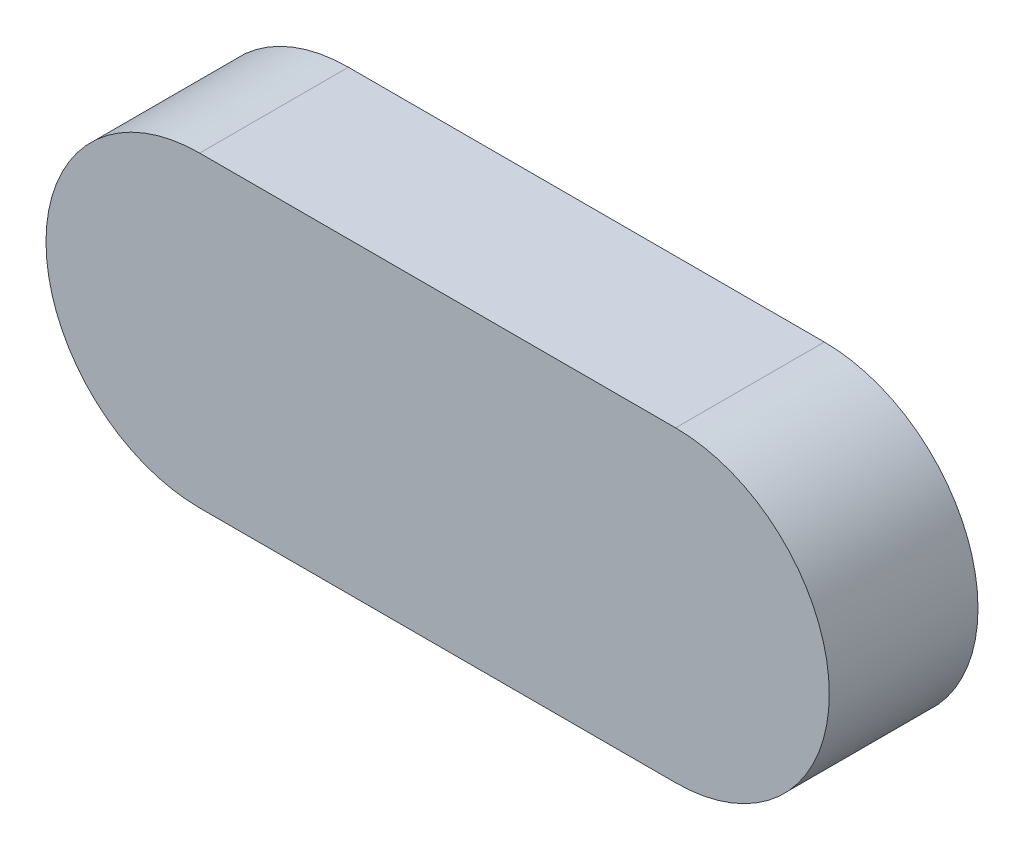
from build123d import *

# Parameters (mm, degrees)
BOSS_EXTRUDE1_DEPTH = 3.75


with BuildPart() as part:
    # Sketch1 → Boss-Extrude1 (new, symmetric)
    with BuildSketch(Plane.XY):
        with BuildLine():
            Line((-12, 7.75), (12, 7.75))
            ThreePointArc((12, 7.75), (19.75, 0), (12, -7.75))
            Line((12, -7.75), (-12, -7.75))
            ThreePointArc((-12, -7.75), (-19.75, 0), (-12, 7.75))
        make_face()
    extrude(amount=BOSS_EXTRUDE1_DEPTH, both=True)


solid = part.part
